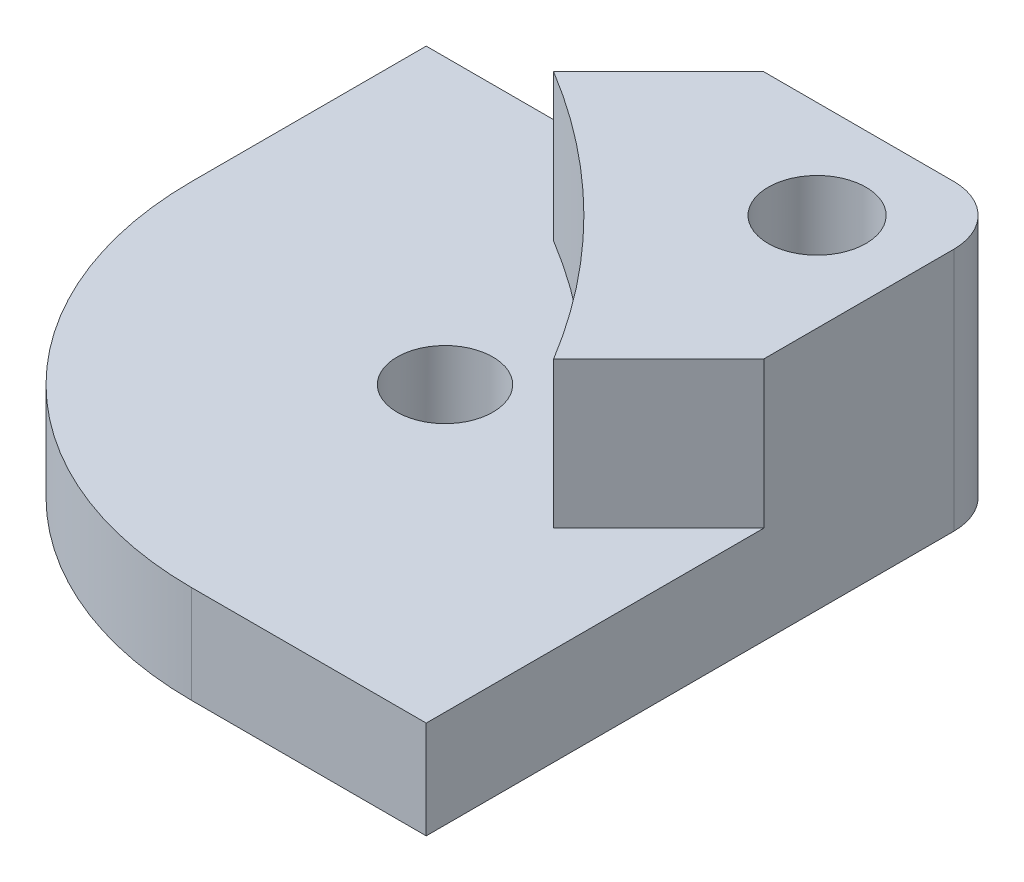
from build123d import *

# Parameters (mm, degrees)
SKETCH1_W               = 190.5
SKETCH1_H               = 190.5
BOSS_EXTRUDE1_DEPTH     = 12.7
FILLET1_R               = 7.62
BOSS_EXTRUDE3_START     = 19.05
BOSS_EXTRUDE3_DEPTH     = 19.05
CIRPATTERN1_COUNT       = 4
SKETCH8_R               = 6.223
CUT_EXTRUDE2_DEPTH      = 25.4
CUT_EXTRUDE6_DEPTH      = 137.044211564
CUT_EXTRUDE6_DEPTH_BACK = 137.044211564
SKETCH10_R              = 6.223
SKETCH11_R              = 6.35
SKETCH11_R_2            = 3.2385
CUT_EXTRUDE7_DEPTH      = 19.05
SKETCH11_4_R            = 3.2385
CUT_EXTRUDE8_DEPTH      = 139.395041457
FILLET3_R               = 12.7
BOSS_EXTRUDE5_DEPTH     = 12.7


with BuildPart() as part:
    # Sketch1 → Boss-Extrude1 (new body)
    with BuildSketch(Plane(origin=(0, 0, 0), x_dir=(1, 0, 0), z_dir=(0, 1, 0))):
        Rectangle(SKETCH1_W, SKETCH1_H)
    extrude(amount=BOSS_EXTRUDE1_DEPTH)

    # Fillet1
    fillet1_edges = [part.edges().sort_by_distance(p)[0] for p in [
        (95.25, 6.35, 95.25),
        (-95.25, 6.35, 95.25),
        (-95.25, 6.35, -95.25),
        (95.25, 6.35, -95.25),
    ]]
    fillet(fillet1_edges, radius=FILLET1_R)

    # Sketch7 → Boss-Extrude3 (add)
    with BuildSketch(Plane(origin=(0, 12.7, 0), x_dir=(1, 0, 0), z_dir=(0, 1, 0)).offset(BOSS_EXTRUDE3_START)):
        with BuildLine():
            Line((67.396822189, 67.396822189), (93.018153673, 93.018153673))
            ThreePointArc((93.018153673, 93.018153673), (90.546047755, 94.669962038), (87.63, 95.25))
            Line((87.63, 95.25), (62.921077964, 95.25))
            Line((62.921077964, 95.25), (49.265209936, 81.594131972))
            ThreePointArc((49.265209936, 81.594131972), (58.761367718, 75.045086089), (67.396822189, 67.396822189))
        make_face()
        with BuildLine():
            ThreePointArc((95.25, 87.63), (94.669962038, 90.546047755), (93.018153673, 93.018153673))
            Line((93.018153673, 93.018153673), (67.396822189, 67.396822189))
            ThreePointArc((67.396822189, 67.396822189), (75.045086089, 58.761367718), (81.594131972, 49.265209936))
            Line((81.594131972, 49.265209936), (95.25, 62.921077964))
            Line((95.25, 62.921077964), (95.25, 87.63))
        make_face()
    boss_extrude3 = extrude(amount=-BOSS_EXTRUDE3_DEPTH)

    # CirPattern1: Boss-Extrude3 ×4 about axis
    cirpattern1_axis = Axis((0, 0, 0), (0, 1, 0))
    for i in range(1, CIRPATTERN1_COUNT):
        add(boss_extrude3.rotate(cirpattern1_axis, i * 360 / CIRPATTERN1_COUNT))

    # Sketch8 → Cut-Extrude2 (cut)
    with BuildSketch(Plane(origin=(0, 12.7, 0), x_dir=(1, 0, 0), z_dir=(0, 1, 0))):
        with Locations(Location((0, 82.55, 0), (0, 0, 270))):
            Circle(SKETCH8_R)
        with Locations(Location((58.371664787, 58.371664787, 0), (0, 0, 270))):
            Circle(SKETCH8_R)
        with Locations(Location((82.55, 0, 0), (0, 0, 270))):
            Circle(SKETCH8_R)
        with Locations(Location((58.371664787, -58.371664787, 0), (0, 0, 270))):
            Circle(SKETCH8_R)
        with Locations(Location((0, -82.55, 0), (0, 0, 270))):
            Circle(SKETCH8_R)
        with Locations(Location((-58.371664787, -58.371664787, 0), (0, 0, 270))):
            Circle(SKETCH8_R)
        with Locations(Location((-82.55, 0, 0), (0, 0, 270))):
            Circle(SKETCH8_R)
        with Locations(Location((-58.371664787, 58.371664787, 0), (0, 0, 270))):
            Circle(SKETCH8_R)
    extrude(amount=-CUT_EXTRUDE2_DEPTH, mode=Mode.SUBTRACT)

    # Sketch10 → Cut-Extrude6 (cut, two sides: drawn at the far end of the back side and taken through both)
    with BuildSketch(Plane(origin=(0, 12.7, 0), x_dir=(1, 0, 0), z_dir=(0, 1, 0)).offset(-CUT_EXTRUDE6_DEPTH_BACK)):
        with BuildLine():
            Line((95.25, -62.921077964), (95.25, 38.1))
            Line((95.25, 38.1), (38.1, 38.1))
            Line((38.1, 38.1), (38.1, 95.25))
            Line((38.1, 95.25), (-62.921077964, 95.25))
            Line((-62.921077964, 95.25), (-49.265209936, 81.594131972))
            ThreePointArc((-49.265209936, 81.594131972), (-67.396822189, 67.396822189), (-81.594131972, 49.265209936))
            Line((-81.594131972, 49.265209936), (-95.25, 62.921077964))
            Line((-95.25, 62.921077964), (-95.25, -62.921077964))
            Line((-95.25, -62.921077964), (-81.594131972, -49.265209936))
            ThreePointArc((-81.594131972, -49.265209936), (-67.396822189, -67.396822189), (-49.265209936, -81.594131972))
            Line((-49.265209936, -81.594131972), (-62.921077964, -95.25))
            Line((-62.921077964, -95.25), (62.921077964, -95.25))
            Line((62.921077964, -95.25), (49.265209936, -81.594131972))
            ThreePointArc((49.265209936, -81.594131972), (67.396822189, -67.396822189), (81.594131972, -49.265209936))
            Line((81.594131972, -49.265209936), (95.25, -62.921077964))
        make_face()
        with Locations((-58.371664787, -58.371664787)):
            Circle(SKETCH10_R, mode=Mode.SUBTRACT)
        with Locations((-82.55, 0)):
            Circle(SKETCH10_R, mode=Mode.SUBTRACT)
        with Locations((0, -82.55)):
            Circle(SKETCH10_R, mode=Mode.SUBTRACT)
        with Locations((58.371664787, -58.371664787)):
            Circle(SKETCH10_R, mode=Mode.SUBTRACT)
        with Locations((-58.371664787, 58.371664787)):
            Circle(SKETCH10_R, mode=Mode.SUBTRACT)
        with Locations((0, 82.55)):
            Circle(SKETCH10_R, mode=Mode.SUBTRACT)
        with Locations((82.55, 0)):
            Circle(SKETCH10_R, mode=Mode.SUBTRACT)
    extrude(amount=CUT_EXTRUDE6_DEPTH + CUT_EXTRUDE6_DEPTH_BACK, mode=Mode.SUBTRACT)


with BuildPart() as cut_extrude6_kept_piece:
    # of the separate pieces the step leaves, the one the design keeps (cut_extrude6_pieces_kept)
    add(part.part.solids().sort_by_distance((38.1, 0, -38.1))[0])

    # Sketch11 → Cut-Extrude7 (cut)
    with BuildSketch(Plane(origin=(0, 31.75, 0), x_dir=(1, 0, 0), z_dir=(0, 1, 0))):
        with Locations(Location((82.55, 82.55, 0), (0, 0, 270))):
            Circle(SKETCH11_R)
        with Locations(Location((82.55, 82.55, 0), (0, 0, 270))):
            Circle(SKETCH11_R_2, mode=Mode.SUBTRACT)
    extrude(amount=-CUT_EXTRUDE7_DEPTH, mode=Mode.SUBTRACT)

    # Sketch11<4> → Cut-Extrude8 (cut, through all)
    with BuildSketch(Plane(origin=(0, 31.75, 0), x_dir=(1, 0, 0), z_dir=(0, 1, 0))):
        with Locations(Location((82.55, 82.55, 0), (0, 0, 270))):
            Circle(SKETCH11_4_R)
    extrude(amount=-CUT_EXTRUDE8_DEPTH, mode=Mode.SUBTRACT)

    # Fillet3
    fillet3_edges = [cut_extrude6_kept_piece.edges().sort_by_distance(p)[0] for p in [
        (38.1, 6.35, -95.25),
        (38.1, 6.35, -38.1),
        (95.25, 6.35, -38.1),
    ]]
    fillet(fillet3_edges, radius=FILLET3_R)

    # Sketch12 → Boss-Extrude5 (add)
    with BuildSketch(Plane(origin=(0, 12.7, 0), x_dir=(1, 0, 0), z_dir=(0, 1, 0))):
        with BuildLine():
            ThreePointArc((38.1, 82.55), (41.819743879, 91.530256121), (50.8, 95.25))
            Line((50.8, 95.25), (19.05, 95.25))
            Line((19.05, 95.25), (19.05, 64.77))
            Line((19.05, 64.77), (38.1, 64.77))
            Line((38.1, 64.77), (38.1, 82.55))
        make_face()
        with BuildLine():
            Line((82.55, 38.1), (64.77, 38.1))
            Line((64.77, 38.1), (64.77, 19.05))
            Line((64.77, 19.05), (95.25, 19.05))
            Line((95.25, 19.05), (95.25, 50.8))
            ThreePointArc((95.25, 50.8), (91.530256121, 41.819743879), (82.55, 38.1))
        make_face()
        with BuildLine():
            Line((38.1, 50.8), (38.1, 64.77))
            Line((38.1, 64.77), (19.05, 64.77))
            ThreePointArc((19.05, 64.77), (32.441077964, 32.441077964), (64.77, 19.05))
            Line((64.77, 19.05), (64.77, 38.1))
            Line((64.77, 38.1), (50.8, 38.1))
            ThreePointArc((50.8, 38.1), (41.819743879, 41.819743879), (38.1, 50.8))
        make_face()
    extrude(amount=-BOSS_EXTRUDE5_DEPTH)


solid = cut_extrude6_kept_piece.part
